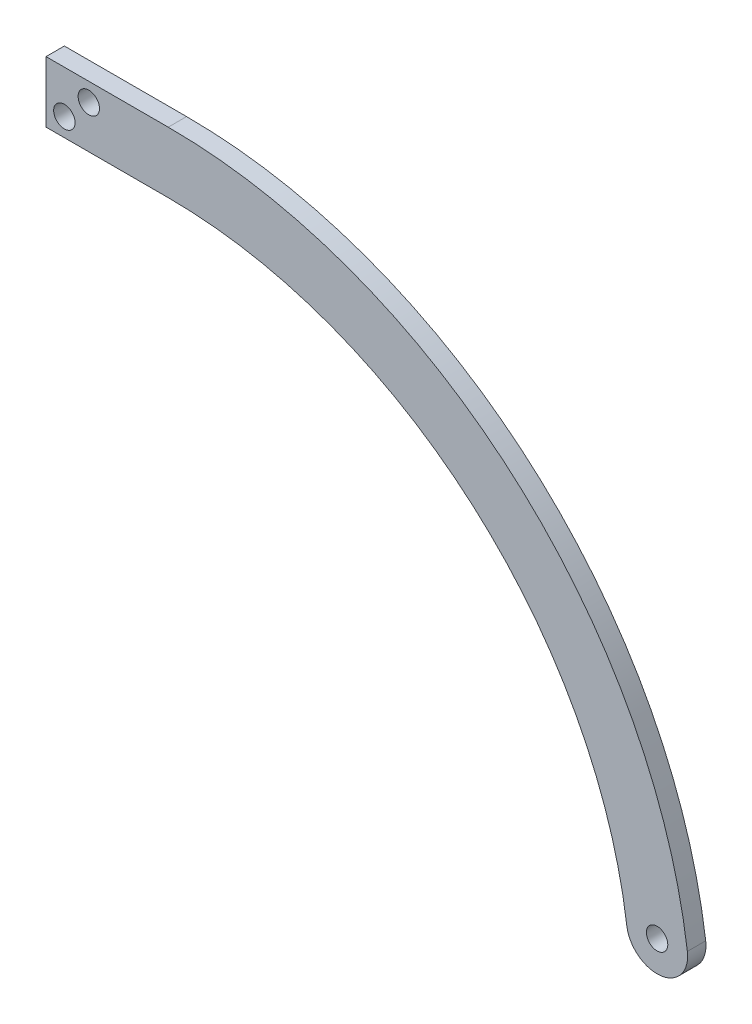
from build123d import *

# Parameters (mm, degrees)
ESBO_O1_R                = 1.75
RESSALTO_EXTRUS_O1_DEPTH = 3


with BuildPart() as part:
    # Esboço1 → Ressalto-extrusão1 (new body)
    # profile 1 of 3: a face of its own
    with BuildSketch(Plane.XY):
        with BuildLine():
            ThreePointArc((0, 5), (-5, 0), (0, -5))
            Line((0, -5), (-20, -5))
            Line((-20, -5), (-20, 5))
            Line((-20, 5), (0, 5))
        make_face()
        with Locations((-17, -2)):
            Circle(ESBO_O1_R, mode=Mode.SUBTRACT)
        with Locations((-13, 2)):
            Circle(ESBO_O1_R, mode=Mode.SUBTRACT)
    # profile 2 of 3: a face of its own
    with BuildSketch(Plane.XY):
        with BuildLine():
            ThreePointArc((75.044247788, -70.663716814), (49.858206024, -23.733478829), (0, -5))
            Line((0, -5), (0, 5))
            ThreePointArc((0, 5), (56.443252103, -16.207711882), (84.955752212, -69.336283186))
            ThreePointArc((84.955752212, -69.336283186), (80.663716814, -74.955752212), (75.044247788, -70.663716814))
        make_face()
        with Locations((80, -70)):
            Circle(ESBO_O1_R, mode=Mode.SUBTRACT)
    # profile 3 of 3: a face of its own
    with BuildSketch(Plane.XY):
        with BuildLine():
            Line((0, 5), (0, -5))
            ThreePointArc((0, -5), (-5, 0), (0, 5))
        make_face()
    extrude(amount=RESSALTO_EXTRUS_O1_DEPTH)


solid = part.part
